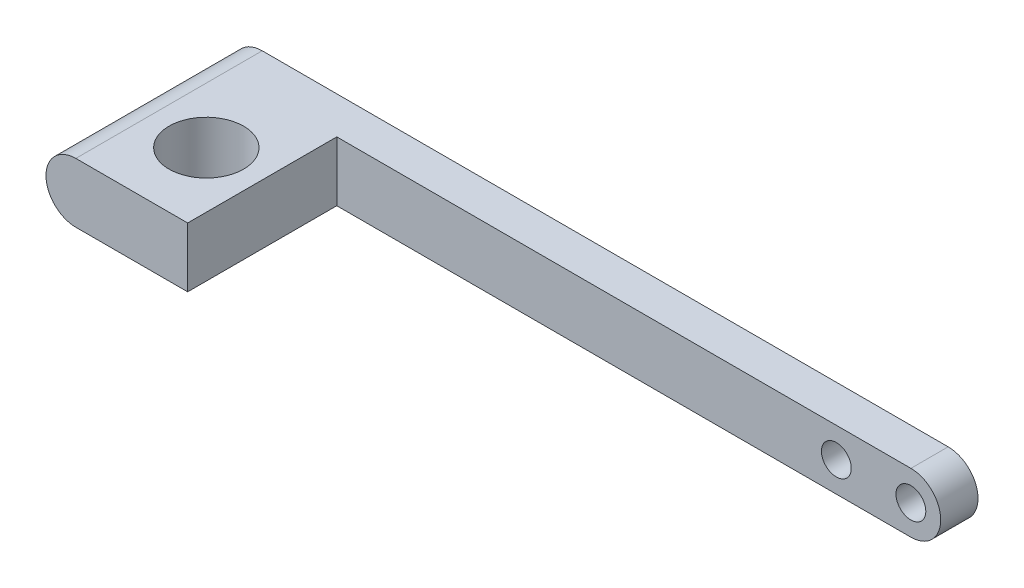
from build123d import *

# Parameters (mm, degrees)
SKETCH_1_W          = 100
SKETCH_1_H          = 5
EXTRUDE_1_DEPTH     = 8
SKETCH_2_R          = 1.1
CUT_EXTRUDE_1_DEPTH = 51.882216933
SKETCH_2_3_R        = 2
CUT_EXTRUDE_2_DEPTH = 3
CUT_EXTRUDE_3_DEPTH = 51.882216933
CUT_EXTRUDE_4_DEPTH = 51.882216933
EXTRUDE_START       = 20
SKETCH_4_W          = 15
SKETCH_4_H          = 8
EXTRUDE_2_DEPTH     = 20
CUT_EXTRUDE_5_DEPTH = 56.409836672


with BuildPart() as part:
    # 草图1 → 凸台-拉伸1 (new body)
    with BuildSketch(Plane(origin=(0, 0, 0), x_dir=(1, 0, 0), z_dir=(0, 1, 0))):
        Rectangle(SKETCH_1_W, SKETCH_1_H)
    extrude(amount=EXTRUDE_1_DEPTH)

    # 草图2 → 切除-拉伸1 (cut, through all)
    with BuildSketch(Plane.XY.offset(2.5)):
        with Locations((46, 4)):
            Circle(SKETCH_2_R)
        with Locations((36, 4)):
            Circle(SKETCH_2_R)
    extrude(amount=-CUT_EXTRUDE_1_DEPTH, mode=Mode.SUBTRACT)

    # 草图2<3> → 切除-拉伸2 (cut)
    with BuildSketch(Plane.XY.offset(2.5)):
        with Locations((36, 4)):
            Circle(SKETCH_2_3_R)
        with Locations((46, 4)):
            Circle(SKETCH_2_3_R)
    extrude(amount=-CUT_EXTRUDE_2_DEPTH, mode=Mode.SUBTRACT)

    # 草图3 → 切除-拉伸3 (cut, through all)
    with BuildSketch(Plane.XY.offset(2.5)):
        with BuildLine():
            ThreePointArc((50, 4), (48.828427125, 1.171572875), (46, 0))
            Line((46, 0), (50, 0))
            Line((50, 0), (50, 4))
        make_face()
        with BuildLine():
            Line((50, 8), (46, 8))
            ThreePointArc((46, 8), (48.828427125, 6.828427125), (50, 4))
            Line((50, 4), (50, 8))
        make_face()
    extrude(amount=-CUT_EXTRUDE_3_DEPTH, mode=Mode.SUBTRACT)

    # 草图3<3> → 切除-拉伸4 (cut, through all)
    with BuildSketch(Plane.XY.offset(2.5)):
        with BuildLine():
            ThreePointArc((-50, 4), (-48.828427125, 6.828427125), (-46, 8))
            Line((-46, 8), (-50, 8))
            Line((-50, 8), (-50, 4))
        make_face()
        with BuildLine():
            Line((-50, 0), (-46, 0))
            ThreePointArc((-46, 0), (-48.828427125, 1.171572875), (-50, 4))
            Line((-50, 4), (-50, 0))
        make_face()
    extrude(amount=-CUT_EXTRUDE_4_DEPTH, mode=Mode.SUBTRACT)

    # 草图4 → 凸台-拉伸2 (add)
    with BuildSketch(Plane.XY.offset(2.5).offset(EXTRUDE_START)):
        with BuildLine():
            Line((-46, 0), (-46, 8))
            ThreePointArc((-46, 8), (-50, 4), (-46, 0))
        make_face()
        with Locations((-38.5, 4)):
            Rectangle(SKETCH_4_W, SKETCH_4_H)
    extrude(amount=-EXTRUDE_2_DEPTH)

    # 草图5 → 切除-拉伸5 (cut, through all)
    with BuildSketch(Plane.XZ):
        with BuildLine():
            ThreePointArc((-33.5, 12.5), (-38.5, 17.5), (-43.5, 12.5))
            Line((-43.5, 12.5), (-33.5, 12.5))
        make_face()
        with BuildLine():
            Line((-33.5, 12.5), (-43.5, 12.5))
            ThreePointArc((-43.5, 12.5), (-38.5, 7.5), (-33.5, 12.5))
        make_face()
    extrude(amount=-CUT_EXTRUDE_5_DEPTH, mode=Mode.SUBTRACT)


solid = part.part
